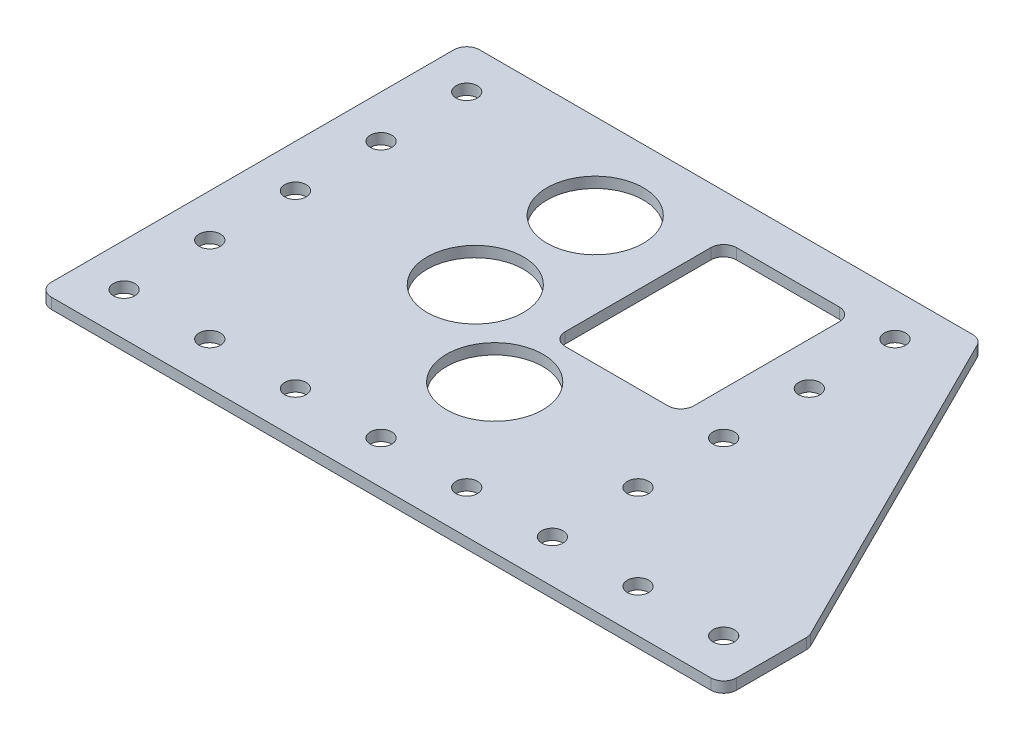
from build123d import *

# Parameters (mm, degrees)
SKETCH1_R           = 14.2875
SKETCH1_R_2         = 3.175
SKETCH1_W           = 38.1
SKETCH1_H           = 50.8
BOSS_EXTRUDE1_DEPTH = 3.175
FILLET1_R           = 3.81


with BuildPart() as part:
    # Sketch1 → Boss-Extrude1 (new body)
    with BuildSketch(Plane(origin=(0, 0, 0), x_dir=(1, 0, 0), z_dir=(0, 1, 0))):
        Polygon((0, 0), (0, 127), (152.4, 127), (203.2, 25.4), (203.2, 0), align=None)
        with Locations(Location((63.5, 101.6, 0), (0, 0, 270))):
            Circle(SKETCH1_R, mode=Mode.SUBTRACT)
        with Locations(Location((63.5, 66.04, 0), (0, 0, 270))):
            Circle(SKETCH1_R, mode=Mode.SUBTRACT)
        with Locations(Location((91.360222469, 43.942, 0), (0, 0, 270))):
            Circle(SKETCH1_R, mode=Mode.SUBTRACT)
        with Locations(Location((12.7, 12.7, 0), (0, 0, 270))):
            Circle(SKETCH1_R_2, mode=Mode.SUBTRACT)
        with Locations(Location((38.1, 12.7, 0), (0, 0, 270))):
            Circle(SKETCH1_R_2, mode=Mode.SUBTRACT)
        with Locations(Location((63.5, 12.7, 0), (0, 0, 270))):
            Circle(SKETCH1_R_2, mode=Mode.SUBTRACT)
        with Locations(Location((88.9, 12.7, 0), (0, 0, 270))):
            Circle(SKETCH1_R_2, mode=Mode.SUBTRACT)
        with Locations(Location((114.3, 12.7, 0), (0, 0, 270))):
            Circle(SKETCH1_R_2, mode=Mode.SUBTRACT)
        with Locations(Location((139.7, 12.7, 0), (0, 0, 270))):
            Circle(SKETCH1_R_2, mode=Mode.SUBTRACT)
        with Locations(Location((165.1, 12.7, 0), (0, 0, 270))):
            Circle(SKETCH1_R_2, mode=Mode.SUBTRACT)
        with Locations(Location((190.5, 12.7, 0), (0, 0, 270))):
            Circle(SKETCH1_R_2, mode=Mode.SUBTRACT)
        with Locations(Location((12.7, 38.1, 0), (0, 0, 270))):
            Circle(SKETCH1_R_2, mode=Mode.SUBTRACT)
        with Locations(Location((12.7, 63.5, 0), (0, 0, 270))):
            Circle(SKETCH1_R_2, mode=Mode.SUBTRACT)
        with Locations(Location((12.7, 88.9, 0), (0, 0, 270))):
            Circle(SKETCH1_R_2, mode=Mode.SUBTRACT)
        with Locations(Location((12.7, 114.3, 0), (0, 0, 270))):
            Circle(SKETCH1_R_2, mode=Mode.SUBTRACT)
        with Locations(Location((139.7, 38.1, 0), (0, 0, 270))):
            Circle(SKETCH1_R_2, mode=Mode.SUBTRACT)
        with Locations(Location((139.7, 63.5, 0), (0, 0, 270))):
            Circle(SKETCH1_R_2, mode=Mode.SUBTRACT)
        with Locations(Location((139.7, 88.9, 0), (0, 0, 270))):
            Circle(SKETCH1_R_2, mode=Mode.SUBTRACT)
        with Locations(Location((139.7, 114.3, 0), (0, 0, 270))):
            Circle(SKETCH1_R_2, mode=Mode.SUBTRACT)
        with Locations((107.95, 88.9)):
            Rectangle(SKETCH1_W, SKETCH1_H, mode=Mode.SUBTRACT)
    extrude(amount=BOSS_EXTRUDE1_DEPTH)

    # Fillet1
    fillet1_edges = [part.edges().sort_by_distance(p)[0] for p in [
        (88.9, 1.5875, -114.3),
        (88.9, 1.5875, -63.5),
        (127, 1.5875, -63.5),
        (127, 1.5875, -114.3),
        (0, 1.5875, 0),
        (0, 1.5875, -127),
        (152.4, 1.5875, -127),
        (203.2, 1.5875, -25.4),
        (203.2, 1.5875, 0),
    ]]
    fillet(fillet1_edges, radius=FILLET1_R)


solid = part.part
